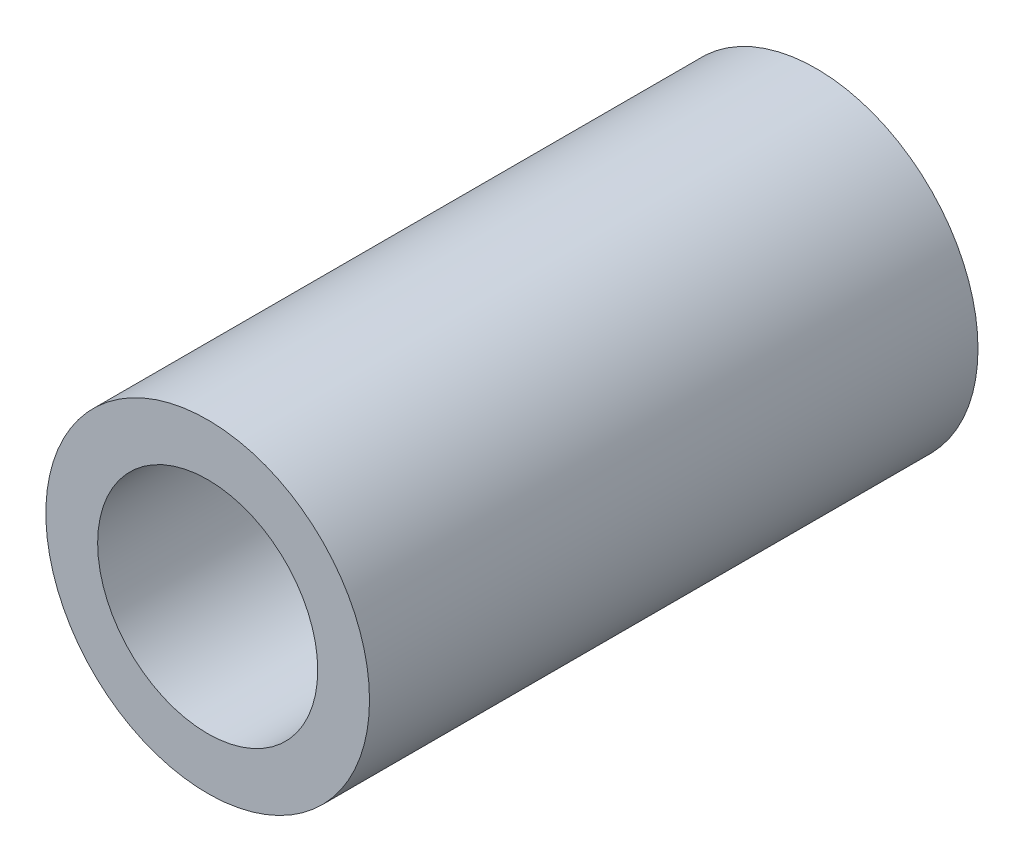
from build123d import *

# Parameters (mm, degrees)
SKETCH1_R               = 2.5
BOSS_EXTRUDE1_DEPTH     = 9.4
CUT_EXTRUDE1_DEPTH      = 11.042907945
CUT_EXTRUDE1_DEPTH_BACK = 11.042907945
SKETCH2_R               = 1.7


with BuildPart() as part:
    # Sketch1 → Boss-Extrude1 (new body)
    with BuildSketch(Plane(origin=(0, 0, 0), x_dir=(0, 1, 0), z_dir=(0, 0, 1))):
        with Locations(Location((0, 0, 0), (0, 0, 270))):
            Circle(SKETCH1_R)
    extrude(amount=BOSS_EXTRUDE1_DEPTH)

    # Sketch2 → Cut-Extrude1 (cut, two sides: drawn at the far end of the back side and taken through both)
    with BuildSketch(Plane.XY.offset(9.4).offset(-CUT_EXTRUDE1_DEPTH_BACK)):
        Circle(SKETCH2_R)
    extrude(amount=CUT_EXTRUDE1_DEPTH + CUT_EXTRUDE1_DEPTH_BACK, mode=Mode.SUBTRACT)


solid = part.part
